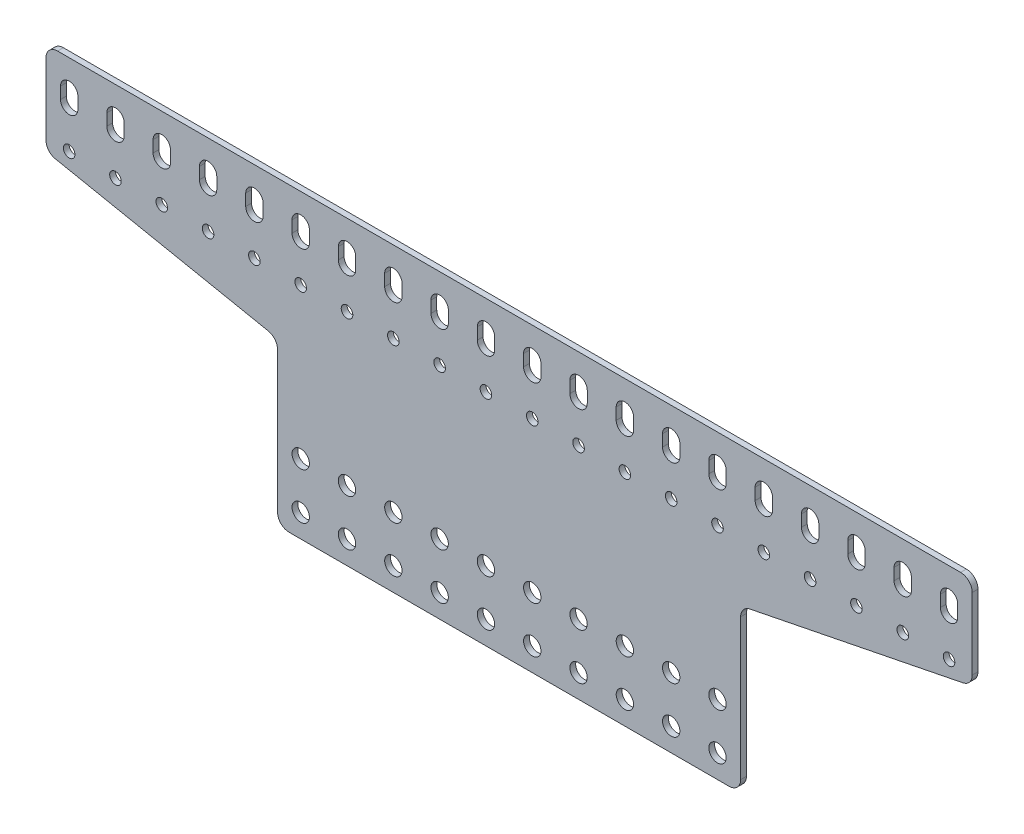
from build123d import *

# Parameters (mm, degrees)
SKETCH1_R           = 3.175
SKETCH1_R_2         = 4.7625
BOSS_EXTRUDE1_DEPTH = 1.5875
FILLET1_R           = 6.35


with BuildPart() as part:
    # Sketch1 → Boss-Extrude1 (new, symmetric)
    with BuildSketch(Plane.XY):
        Polygon((127, 82.55), (254, 82.55), (254, 31.75), (127, 6.35), (127, -82.55), (-127, -82.55), (-127, 6.35), (-254, 31.75), (-254, 82.55), (-127, 82.55), align=None)
        with Locations((-241.3, 38.1)):
            Circle(SKETCH1_R, mode=Mode.SUBTRACT)
        with Locations((-215.9, 38.1)):
            Circle(SKETCH1_R, mode=Mode.SUBTRACT)
        with Locations((-190.5, 38.1)):
            Circle(SKETCH1_R, mode=Mode.SUBTRACT)
        with Locations((-165.1, 38.1)):
            Circle(SKETCH1_R, mode=Mode.SUBTRACT)
        with Locations((-139.7, 38.1)):
            Circle(SKETCH1_R, mode=Mode.SUBTRACT)
        with Locations((-114.3, 38.1)):
            Circle(SKETCH1_R, mode=Mode.SUBTRACT)
        with Locations((-88.9, 38.1)):
            Circle(SKETCH1_R, mode=Mode.SUBTRACT)
        with Locations((-63.5, 38.1)):
            Circle(SKETCH1_R, mode=Mode.SUBTRACT)
        with Locations((-38.1, 38.1)):
            Circle(SKETCH1_R, mode=Mode.SUBTRACT)
        with Locations((-12.7, 38.1)):
            Circle(SKETCH1_R, mode=Mode.SUBTRACT)
        with Locations((12.7, 38.1)):
            Circle(SKETCH1_R, mode=Mode.SUBTRACT)
        with Locations((38.1, 38.1)):
            Circle(SKETCH1_R, mode=Mode.SUBTRACT)
        with Locations((63.5, 38.1)):
            Circle(SKETCH1_R, mode=Mode.SUBTRACT)
        with Locations((88.9, 38.1)):
            Circle(SKETCH1_R, mode=Mode.SUBTRACT)
        with Locations((114.3, -44.45)):
            Circle(SKETCH1_R_2, mode=Mode.SUBTRACT)
        with Locations((114.3, -69.85)):
            Circle(SKETCH1_R_2, mode=Mode.SUBTRACT)
        with Locations((88.9, -44.45)):
            Circle(SKETCH1_R_2, mode=Mode.SUBTRACT)
        with Locations((88.9, -69.85)):
            Circle(SKETCH1_R_2, mode=Mode.SUBTRACT)
        with Locations((63.5, -44.45)):
            Circle(SKETCH1_R_2, mode=Mode.SUBTRACT)
        with Locations((63.5, -69.85)):
            Circle(SKETCH1_R_2, mode=Mode.SUBTRACT)
        with Locations((38.1, -44.45)):
            Circle(SKETCH1_R_2, mode=Mode.SUBTRACT)
        with Locations((38.1, -69.85)):
            Circle(SKETCH1_R_2, mode=Mode.SUBTRACT)
        with Locations((12.7, -44.45)):
            Circle(SKETCH1_R_2, mode=Mode.SUBTRACT)
        with Locations((12.7, -69.85)):
            Circle(SKETCH1_R_2, mode=Mode.SUBTRACT)
        with Locations((-12.7, -44.45)):
            Circle(SKETCH1_R_2, mode=Mode.SUBTRACT)
        with Locations((-12.7, -69.85)):
            Circle(SKETCH1_R_2, mode=Mode.SUBTRACT)
        with Locations((-38.1, -44.45)):
            Circle(SKETCH1_R_2, mode=Mode.SUBTRACT)
        with Locations((-38.1, -69.85)):
            Circle(SKETCH1_R_2, mode=Mode.SUBTRACT)
        with Locations((-63.5, -44.45)):
            Circle(SKETCH1_R_2, mode=Mode.SUBTRACT)
        with Locations((-63.5, -69.85)):
            Circle(SKETCH1_R_2, mode=Mode.SUBTRACT)
        with Locations((-88.9, -44.45)):
            Circle(SKETCH1_R_2, mode=Mode.SUBTRACT)
        with Locations((-88.9, -69.85)):
            Circle(SKETCH1_R_2, mode=Mode.SUBTRACT)
        with Locations((-114.3, -44.45)):
            Circle(SKETCH1_R_2, mode=Mode.SUBTRACT)
        with Locations((-114.3, -69.85)):
            Circle(SKETCH1_R_2, mode=Mode.SUBTRACT)
        with Locations((114.3, 38.1)):
            Circle(SKETCH1_R, mode=Mode.SUBTRACT)
        with Locations((139.7, 38.1)):
            Circle(SKETCH1_R, mode=Mode.SUBTRACT)
        with Locations((165.1, 38.1)):
            Circle(SKETCH1_R, mode=Mode.SUBTRACT)
        with Locations((190.5, 38.1)):
            Circle(SKETCH1_R, mode=Mode.SUBTRACT)
        with Locations((215.9, 38.1)):
            Circle(SKETCH1_R, mode=Mode.SUBTRACT)
        with Locations((241.3, 38.1)):
            Circle(SKETCH1_R, mode=Mode.SUBTRACT)
        with BuildLine():
            Line((-236.5375, 66.675), (-236.5375, 60.325))
            ThreePointArc((-236.5375, 60.325), (-241.3, 55.5625), (-246.0625, 60.325))
            Line((-246.0625, 60.325), (-246.0625, 66.675))
            ThreePointArc((-246.0625, 66.675), (-241.3, 71.4375), (-236.5375, 66.675))
        make_face(mode=Mode.SUBTRACT)
        with BuildLine():
            Line((-211.1375, 66.675), (-211.1375, 60.325))
            ThreePointArc((-211.1375, 60.325), (-215.9, 55.5625), (-220.6625, 60.325))
            Line((-220.6625, 60.325), (-220.6625, 66.675))
            ThreePointArc((-220.6625, 66.675), (-215.9, 71.4375), (-211.1375, 66.675))
        make_face(mode=Mode.SUBTRACT)
        with BuildLine():
            Line((-185.7375, 66.675), (-185.7375, 60.325))
            ThreePointArc((-185.7375, 60.325), (-190.5, 55.5625), (-195.2625, 60.325))
            Line((-195.2625, 60.325), (-195.2625, 66.675))
            ThreePointArc((-195.2625, 66.675), (-190.5, 71.4375), (-185.7375, 66.675))
        make_face(mode=Mode.SUBTRACT)
        with BuildLine():
            Line((-160.3375, 66.675), (-160.3375, 60.325))
            ThreePointArc((-160.3375, 60.325), (-165.1, 55.5625), (-169.8625, 60.325))
            Line((-169.8625, 60.325), (-169.8625, 66.675))
            ThreePointArc((-169.8625, 66.675), (-165.1, 71.4375), (-160.3375, 66.675))
        make_face(mode=Mode.SUBTRACT)
        with BuildLine():
            Line((-134.9375, 66.675), (-134.9375, 60.325))
            ThreePointArc((-134.9375, 60.325), (-139.7, 55.5625), (-144.4625, 60.325))
            Line((-144.4625, 60.325), (-144.4625, 66.675))
            ThreePointArc((-144.4625, 66.675), (-139.7, 71.4375), (-134.9375, 66.675))
        make_face(mode=Mode.SUBTRACT)
        with BuildLine():
            Line((-109.5375, 66.675), (-109.5375, 60.325))
            ThreePointArc((-109.5375, 60.325), (-114.3, 55.5625), (-119.0625, 60.325))
            Line((-119.0625, 60.325), (-119.0625, 66.675))
            ThreePointArc((-119.0625, 66.675), (-114.3, 71.4375), (-109.5375, 66.675))
        make_face(mode=Mode.SUBTRACT)
        with BuildLine():
            Line((-84.1375, 66.675), (-84.1375, 60.325))
            ThreePointArc((-84.1375, 60.325), (-88.9, 55.5625), (-93.6625, 60.325))
            Line((-93.6625, 60.325), (-93.6625, 66.675))
            ThreePointArc((-93.6625, 66.675), (-88.9, 71.4375), (-84.1375, 66.675))
        make_face(mode=Mode.SUBTRACT)
        with BuildLine():
            Line((-58.7375, 66.675), (-58.7375, 60.325))
            ThreePointArc((-58.7375, 60.325), (-63.5, 55.5625), (-68.2625, 60.325))
            Line((-68.2625, 60.325), (-68.2625, 66.675))
            ThreePointArc((-68.2625, 66.675), (-63.5, 71.4375), (-58.7375, 66.675))
        make_face(mode=Mode.SUBTRACT)
        with BuildLine():
            Line((-33.3375, 66.675), (-33.3375, 60.325))
            ThreePointArc((-33.3375, 60.325), (-38.1, 55.5625), (-42.8625, 60.325))
            Line((-42.8625, 60.325), (-42.8625, 66.675))
            ThreePointArc((-42.8625, 66.675), (-38.1, 71.4375), (-33.3375, 66.675))
        make_face(mode=Mode.SUBTRACT)
        with BuildLine():
            Line((-7.9375, 66.675), (-7.9375, 60.325))
            ThreePointArc((-7.9375, 60.325), (-12.7, 55.5625), (-17.4625, 60.325))
            Line((-17.4625, 60.325), (-17.4625, 66.675))
            ThreePointArc((-17.4625, 66.675), (-12.7, 71.4375), (-7.9375, 66.675))
        make_face(mode=Mode.SUBTRACT)
        with BuildLine():
            Line((17.4625, 66.675), (17.4625, 60.325))
            ThreePointArc((17.4625, 60.325), (12.7, 55.5625), (7.9375, 60.325))
            Line((7.9375, 60.325), (7.9375, 66.675))
            ThreePointArc((7.9375, 66.675), (12.7, 71.4375), (17.4625, 66.675))
        make_face(mode=Mode.SUBTRACT)
        with BuildLine():
            Line((42.8625, 66.675), (42.8625, 60.325))
            ThreePointArc((42.8625, 60.325), (38.1, 55.5625), (33.3375, 60.325))
            Line((33.3375, 60.325), (33.3375, 66.675))
            ThreePointArc((33.3375, 66.675), (38.1, 71.4375), (42.8625, 66.675))
        make_face(mode=Mode.SUBTRACT)
        with BuildLine():
            Line((68.2625, 66.675), (68.2625, 60.325))
            ThreePointArc((68.2625, 60.325), (63.5, 55.5625), (58.7375, 60.325))
            Line((58.7375, 60.325), (58.7375, 66.675))
            ThreePointArc((58.7375, 66.675), (63.5, 71.4375), (68.2625, 66.675))
        make_face(mode=Mode.SUBTRACT)
        with BuildLine():
            Line((93.6625, 66.675), (93.6625, 60.325))
            ThreePointArc((93.6625, 60.325), (88.9, 55.5625), (84.1375, 60.325))
            Line((84.1375, 60.325), (84.1375, 66.675))
            ThreePointArc((84.1375, 66.675), (88.9, 71.4375), (93.6625, 66.675))
        make_face(mode=Mode.SUBTRACT)
        with BuildLine():
            Line((119.0625, 66.675), (119.0625, 60.325))
            ThreePointArc((119.0625, 60.325), (114.3, 55.5625), (109.5375, 60.325))
            Line((109.5375, 60.325), (109.5375, 66.675))
            ThreePointArc((109.5375, 66.675), (114.3, 71.4375), (119.0625, 66.675))
        make_face(mode=Mode.SUBTRACT)
        with BuildLine():
            Line((144.4625, 66.675), (144.4625, 60.325))
            ThreePointArc((144.4625, 60.325), (139.7, 55.5625), (134.9375, 60.325))
            Line((134.9375, 60.325), (134.9375, 66.675))
            ThreePointArc((134.9375, 66.675), (139.7, 71.4375), (144.4625, 66.675))
        make_face(mode=Mode.SUBTRACT)
        with BuildLine():
            Line((169.8625, 66.675), (169.8625, 60.325))
            ThreePointArc((169.8625, 60.325), (165.1, 55.5625), (160.3375, 60.325))
            Line((160.3375, 60.325), (160.3375, 66.675))
            ThreePointArc((160.3375, 66.675), (165.1, 71.4375), (169.8625, 66.675))
        make_face(mode=Mode.SUBTRACT)
        with BuildLine():
            Line((195.2625, 66.675), (195.2625, 60.325))
            ThreePointArc((195.2625, 60.325), (190.5, 55.5625), (185.7375, 60.325))
            Line((185.7375, 60.325), (185.7375, 66.675))
            ThreePointArc((185.7375, 66.675), (190.5, 71.4375), (195.2625, 66.675))
        make_face(mode=Mode.SUBTRACT)
        with BuildLine():
            Line((220.6625, 66.675), (220.6625, 60.325))
            ThreePointArc((220.6625, 60.325), (215.9, 55.5625), (211.1375, 60.325))
            Line((211.1375, 60.325), (211.1375, 66.675))
            ThreePointArc((211.1375, 66.675), (215.9, 71.4375), (220.6625, 66.675))
        make_face(mode=Mode.SUBTRACT)
        with BuildLine():
            Line((246.0625, 66.675), (246.0625, 60.325))
            ThreePointArc((246.0625, 60.325), (241.3, 55.5625), (236.5375, 60.325))
            Line((236.5375, 60.325), (236.5375, 66.675))
            ThreePointArc((236.5375, 66.675), (241.3, 71.4375), (246.0625, 66.675))
        make_face(mode=Mode.SUBTRACT)
    extrude(amount=BOSS_EXTRUDE1_DEPTH, both=True)

    # Fillet1
    fillet1_edges = [part.edges().sort_by_distance(p)[0] for p in [
        (254, 82.55, 0),
        (254, 31.75, 0),
        (127, 6.35, 0),
        (127, -82.55, 0),
        (-127, -82.55, 0),
        (-127, 6.35, 0),
        (-254, 31.75, 0),
        (-254, 82.55, 0),
    ]]
    fillet(fillet1_edges, radius=FILLET1_R)


solid = part.part
